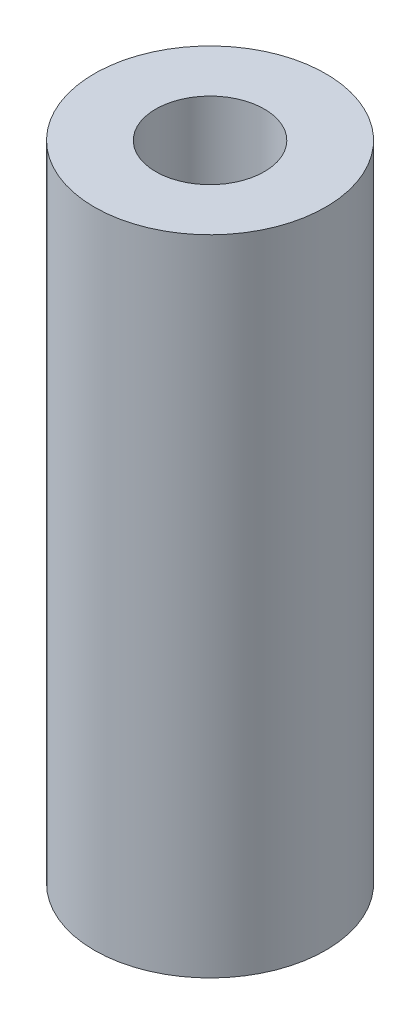
from build123d import *

# Parameters (mm, degrees)
SKETCH1_R           = 73.025
SKETCH1_R_2         = 34.29
BOSS_EXTRUDE1_DEPTH = 406.4


with BuildPart() as part:
    # Sketch1 → Boss-Extrude1 (new body)
    with BuildSketch(Plane(origin=(0, 0, 0), x_dir=(1, 0, 0), z_dir=(0, 1, 0))):
        with Locations(Location((0, 0, 0), (0, 0, 270))):
            Circle(SKETCH1_R)
        with Locations(Location((0, 0, 0), (0, 0, 270))):
            Circle(SKETCH1_R_2, mode=Mode.SUBTRACT)
    extrude(amount=BOSS_EXTRUDE1_DEPTH)


solid = part.part
